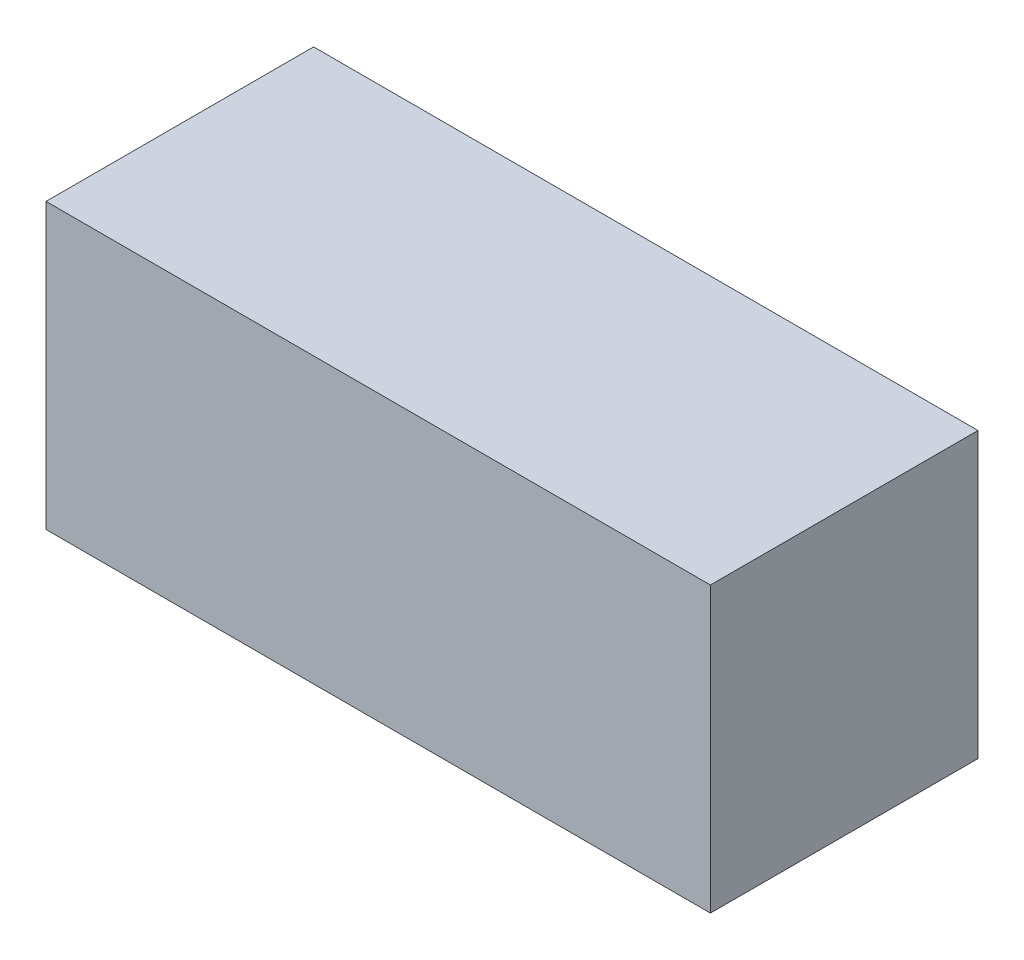
from build123d import *

# Parameters (mm, degrees)
SKETCH1_W           = 6058
SKETCH1_H           = 2440
BOSS_EXTRUDE1_DEPTH = 2591


with BuildPart() as part:
    # Sketch1 → Boss-Extrude1 (new body)
    with BuildSketch(Plane(origin=(0, 0, 0), x_dir=(1, 0, 0), z_dir=(0, 1, 0))):
        with Locations((3029, 1220)):
            Rectangle(SKETCH1_W, SKETCH1_H)
    extrude(amount=BOSS_EXTRUDE1_DEPTH)


solid = part.part
